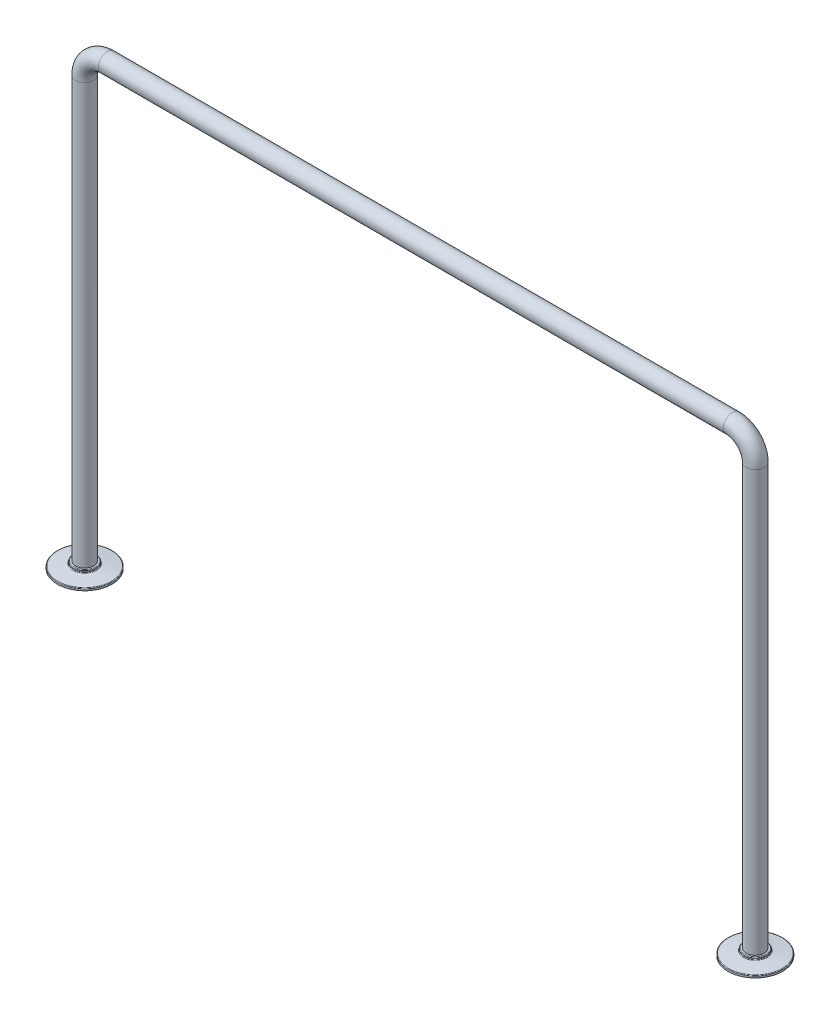
from build123d import *

# Parameters (mm, degrees)
SKETCH3_R          = 4
SKETCH5_R          = 2
CUT_EXTRUDE1_DEPTH = 10
LPATTERN1_COUNT    = 5
LPATTERN1_PITCH    = 50


with BuildPart() as part:
    # Sweep1: sweep along a path in Sketch1
    with BuildLine(Plane.XY) as sweep1_path:
        Line((-147.5, 0), (-147.5, 185))
        ThreePointArc((-147.5, 185), (-144.571067812, 192.071067812), (-137.5, 195))
        Line((-137.5, 195), (137.5, 195))
        ThreePointArc((137.5, 195), (144.571067812, 192.071067812), (147.5, 185))
        Line((147.5, 185), (147.5, 0))
    # Sketch3 → Sweep1 (sweep)
    with BuildSketch(Plane(origin=(0, 0, 0), x_dir=(1, 0, 0), z_dir=(0, 1, 0))):
        with Locations((-147.5, 0)):
            Circle(SKETCH3_R)
    sweep(path=sweep1_path.line)

    # Sketch4 → Revolve1 (revolve)
    with BuildSketch(Plane.XY, mode=Mode.PRIVATE) as revolve1_sk:
        with BuildLine():
            Line((-147.5, 0), (-147.5, -3))
            Line((-147.5, -3), (-159.5, -3))
            Line((-159.5, -3), (-159.5, -2.260188621))
            ThreePointArc((-159.5, -2.260188621), (-159.426636186, -2.063628098), (-159.242426407, -1.963203772))
            Line((-159.242426407, -1.963203772), (-152.757573593, -1.036796228))
            ThreePointArc((-152.757573593, -1.036796228), (-152.573363814, -0.936371902), (-152.5, -0.739811379))
            Line((-152.5, -0.739811379), (-152.5, -0.3))
            ThreePointArc((-152.5, -0.3), (-152.412132034, -0.087867966), (-152.2, 0))
            Line((-152.2, 0), (-147.5, 0))
        make_face()
    revolve1 = revolve(revolve1_sk.sketch.rotate(Axis((-147.5, 0, 0), (0, -1, 0)), 270), axis=Axis((-147.5, 0, 0), (0, -1, 0)))

    # Mirror1: Revolve1 across plane
    add(revolve1.mirror(Plane(origin=(0, 0, 0), x_dir=(0, 0, 1), z_dir=(1, 0, 0))))

    # Sketch5 → Cut-Extrude1 (cut)
    with BuildSketch(Plane.XY):
        with Locations((-100, 195)):
            Circle(SKETCH5_R)
    cut_extrude1 = extrude(amount=-CUT_EXTRUDE1_DEPTH, mode=Mode.SUBTRACT)

    # LPattern1: Cut-Extrude1 ×5
    with Locations(*[(i * LPATTERN1_PITCH, 0, 0) for i in range(1, LPATTERN1_COUNT)]):
        add(cut_extrude1, mode=Mode.SUBTRACT)


solid = part.part
